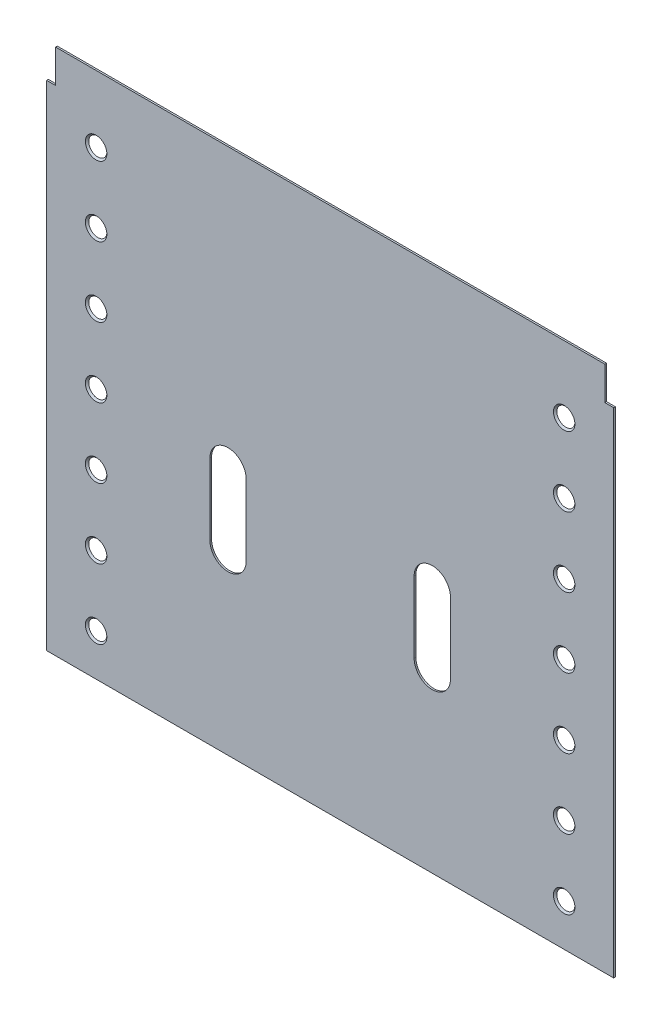
from build123d import *

# Parameters (mm, degrees)
SKETCH1_W                                      = 203.2
SKETCH1_H                                      = 177
BOSS_EXTRUDE1_DEPTH                            = 0.6096
CUT_EXTRUDE7_DEPTH                             = 313.185220041
SKETCH4_W                                      = 196.85
SKETCH4_H                                      = 0.6096
BOSS_EXTRUDE2_DEPTH                            = 12
SKETCH14_W                                     = 196.85
SKETCH14_H                                     = 11.938
BOSS_EXTRUDE3_DEPTH                            = 0.6096
SKETCH13_W                                     = 196.85
SKETCH13_H                                     = 0.6096
CUT_EXTRUDE9_DEPTH                             = 12
CSK_FOR_M3_FLAT_HEAD_MACHINE_SCREW3_AT_2_COUNT = 2
CSK_FOR_M3_FLAT_HEAD_MACHINE_SCREW3_AT_2_PITCH = 25
CSK_FOR_M3_FLAT_HEAD_MACHINE_SCREW3_AT_3_COUNT = 2
CSK_FOR_M3_FLAT_HEAD_MACHINE_SCREW3_AT_3_PITCH = 50
CSK_FOR_M3_FLAT_HEAD_MACHINE_SCREW3_AT_4_COUNT = 2
CSK_FOR_M3_FLAT_HEAD_MACHINE_SCREW3_AT_4_PITCH = 75
CSK_FOR_M3_FLAT_HEAD_MACHINE_SCREW3_AT_5_COUNT = 2
CSK_FOR_M3_FLAT_HEAD_MACHINE_SCREW3_AT_5_PITCH = 100
CSK_FOR_M3_FLAT_HEAD_MACHINE_SCREW3_AT_6_COUNT = 2
CSK_FOR_M3_FLAT_HEAD_MACHINE_SCREW3_AT_6_PITCH = 125
CSK_FOR_M3_FLAT_HEAD_MACHINE_SCREW3_AT_7_COUNT = 2
CSK_FOR_M3_FLAT_HEAD_MACHINE_SCREW3_AT_7_PITCH = 150


with BuildPart() as part:
    # Sketch1 → Boss-Extrude1 (new body)
    with BuildSketch(Plane(origin=(0, 0, 0), x_dir=(1, 0, 0), z_dir=(0, 0, -1))):
        with Locations((-101.6, 148.5)):
            Rectangle(SKETCH1_W, SKETCH1_H)
    extrude(amount=BOSS_EXTRUDE1_DEPTH)

    # Sketch2 → Cut-Extrude7 (cut, through all)
    with BuildSketch(Plane(origin=(0, 0, -0.6096), x_dir=(1, 0, 0), z_dir=(0, 0, -1))):
        with BuildLine():
            Line((-131.7, 173.5), (-131.7, 148))
            ThreePointArc((-131.7, 148), (-138.2, 141.5), (-144.7, 148))
            Line((-144.7, 148), (-144.7, 173.5))
            ThreePointArc((-144.7, 173.5), (-138.2, 180), (-131.7, 173.5))
        make_face()
        with BuildLine():
            Line((-58.5, 173.5), (-58.5, 148))
            ThreePointArc((-58.5, 148), (-65, 141.5), (-71.5, 148))
            Line((-71.5, 148), (-71.5, 173.5))
            ThreePointArc((-71.5, 173.5), (-65, 180), (-58.5, 173.5))
        make_face()
    extrude(amount=-CUT_EXTRUDE7_DEPTH, mode=Mode.SUBTRACT)

    # Sketch4 → Boss-Extrude2 (add)
    with BuildSketch(Plane.XY):
        with Locations((-101.6, -60.3048)):
            Rectangle(SKETCH4_W, SKETCH4_H)
    extrude(amount=BOSS_EXTRUDE2_DEPTH)

    # Sketch14 → Boss-Extrude3 (add)
    with BuildSketch(Plane.XY):
        with Locations((-101.6, -54.031)):
            Rectangle(SKETCH14_W, SKETCH14_H)
    extrude(amount=-BOSS_EXTRUDE3_DEPTH)

    # Sketch13 → Cut-Extrude9 (cut)
    with BuildSketch(Plane.XY.offset(12)):
        with Locations((-101.6, -60.3048)):
            Rectangle(SKETCH13_W, SKETCH13_H)
    extrude(amount=-CUT_EXTRUDE9_DEPTH, mode=Mode.SUBTRACT)

    # Sketch16 → CSK for M3 Flat Head Machine Screw3 (revolve, cut)
    with BuildSketch(Plane(origin=(-185.47, -222, 0), x_dir=(0, -1, 0), z_dir=(1, 0, 0))):
        Polygon((0, 0), (0, 0.6096), (1.7, 0.6096), (1.7, 2.15), (3.85, 0), align=None)
    csk_for_m3_flat_head_machine_screw3 = revolve(axis=Axis((-185.47, -222, 6.35), (0, 0, -1)), mode=Mode.SUBTRACT)

    # CSK for M3 Flat Head Machine Screw3 at 2: CSK for M3 Flat Head Machine Screw3 ×2
    with Locations(*[(0, i * CSK_FOR_M3_FLAT_HEAD_MACHINE_SCREW3_AT_2_PITCH, 0) for i in range(1, CSK_FOR_M3_FLAT_HEAD_MACHINE_SCREW3_AT_2_COUNT)]):
        add(csk_for_m3_flat_head_machine_screw3, mode=Mode.SUBTRACT)

    # CSK for M3 Flat Head Machine Screw3 at 3: CSK for M3 Flat Head Machine Screw3 ×2
    with Locations(*[(0, i * CSK_FOR_M3_FLAT_HEAD_MACHINE_SCREW3_AT_3_PITCH, 0) for i in range(1, CSK_FOR_M3_FLAT_HEAD_MACHINE_SCREW3_AT_3_COUNT)]):
        add(csk_for_m3_flat_head_machine_screw3, mode=Mode.SUBTRACT)

    # CSK for M3 Flat Head Machine Screw3 at 4: CSK for M3 Flat Head Machine Screw3 ×2
    with Locations(*[(0, i * CSK_FOR_M3_FLAT_HEAD_MACHINE_SCREW3_AT_4_PITCH, 0) for i in range(1, CSK_FOR_M3_FLAT_HEAD_MACHINE_SCREW3_AT_4_COUNT)]):
        add(csk_for_m3_flat_head_machine_screw3, mode=Mode.SUBTRACT)

    # CSK for M3 Flat Head Machine Screw3 at 5: CSK for M3 Flat Head Machine Screw3 ×2
    with Locations(*[(0, i * CSK_FOR_M3_FLAT_HEAD_MACHINE_SCREW3_AT_5_PITCH, 0) for i in range(1, CSK_FOR_M3_FLAT_HEAD_MACHINE_SCREW3_AT_5_COUNT)]):
        add(csk_for_m3_flat_head_machine_screw3, mode=Mode.SUBTRACT)

    # CSK for M3 Flat Head Machine Screw3 at 6: CSK for M3 Flat Head Machine Screw3 ×2
    with Locations(*[(0, i * CSK_FOR_M3_FLAT_HEAD_MACHINE_SCREW3_AT_6_PITCH, 0) for i in range(1, CSK_FOR_M3_FLAT_HEAD_MACHINE_SCREW3_AT_6_COUNT)]):
        add(csk_for_m3_flat_head_machine_screw3, mode=Mode.SUBTRACT)

    # CSK for M3 Flat Head Machine Screw3 at 7: CSK for M3 Flat Head Machine Screw3 ×2
    with Locations(*[(0, i * CSK_FOR_M3_FLAT_HEAD_MACHINE_SCREW3_AT_7_PITCH, 0) for i in range(1, CSK_FOR_M3_FLAT_HEAD_MACHINE_SCREW3_AT_7_COUNT)]):
        add(csk_for_m3_flat_head_machine_screw3, mode=Mode.SUBTRACT)

    # Mirror1: CSK for M3 Flat Head Machine Screw3 across plane
    add(csk_for_m3_flat_head_machine_screw3.mirror(Plane.ZY.offset(101.599999995)), mode=Mode.SUBTRACT)

    # Mirror1 copy 1 sketch → Mirror1 copy 1 (revolve, cut)
    with BuildSketch(Plane(origin=(-17.729999998, -197.000000003, 0), x_dir=(-3.839898042745385e-11, -1.0, 0), z_dir=(-1.0, 3.839898042745385e-11, 0))):
        Polygon((0, 0), (0, -0.6096), (1.7, -0.6096), (1.7, -2.15), (3.85, 0), align=None)
    revolve(axis=Axis((-17.729999998, -197.000000003, 6.35), (0, 0, 1)), mode=Mode.SUBTRACT)

    # Mirror1 copy 2 sketch → Mirror1 copy 2 (revolve, cut)
    with BuildSketch(Plane(origin=(-17.729999998, -172.000000003, 0), x_dir=(-3.839898042745385e-11, -1.0, 0), z_dir=(-1.0, 3.839898042745385e-11, 0))):
        Polygon((0, 0), (0, -0.6096), (1.7, -0.6096), (1.7, -2.15), (3.85, 0), align=None)
    revolve(axis=Axis((-17.729999998, -172.000000003, 6.35), (0, 0, 1)), mode=Mode.SUBTRACT)

    # Mirror1 copy 3 sketch → Mirror1 copy 3 (revolve, cut)
    with BuildSketch(Plane(origin=(-17.729999997, -147.000000003, 0), x_dir=(-3.839898042745385e-11, -1.0, 0), z_dir=(-1.0, 3.839898042745385e-11, 0))):
        Polygon((0, 0), (0, -0.6096), (1.7, -0.6096), (1.7, -2.15), (3.85, 0), align=None)
    revolve(axis=Axis((-17.729999997, -147.000000003, 6.35), (0, 0, 1)), mode=Mode.SUBTRACT)

    # Mirror1 copy 4 sketch → Mirror1 copy 4 (revolve, cut)
    with BuildSketch(Plane(origin=(-17.729999996, -122.000000003, 0), x_dir=(-3.839898042745385e-11, -1.0, 0), z_dir=(-1.0, 3.839898042745385e-11, 0))):
        Polygon((0, 0), (0, -0.6096), (1.7, -0.6096), (1.7, -2.15), (3.85, 0), align=None)
    revolve(axis=Axis((-17.729999996, -122.000000003, 6.35), (0, 0, 1)), mode=Mode.SUBTRACT)

    # Mirror1 copy 5 sketch → Mirror1 copy 5 (revolve, cut)
    with BuildSketch(Plane(origin=(-17.729999995, -97.000000003, 0), x_dir=(-3.839898042745385e-11, -1.0, 0), z_dir=(-1.0, 3.839898042745385e-11, 0))):
        Polygon((0, 0), (0, -0.6096), (1.7, -0.6096), (1.7, -2.15), (3.85, 0), align=None)
    revolve(axis=Axis((-17.729999995, -97.000000003, 6.35), (0, 0, 1)), mode=Mode.SUBTRACT)

    # Mirror1 copy 6 sketch → Mirror1 copy 6 (revolve, cut)
    with BuildSketch(Plane(origin=(-17.729999994, -72.000000003, 0), x_dir=(-3.839898042745385e-11, -1.0, 0), z_dir=(-1.0, 3.839898042745385e-11, 0))):
        Polygon((0, 0), (0, -0.6096), (1.7, -0.6096), (1.7, -2.15), (3.85, 0), align=None)
    revolve(axis=Axis((-17.729999994, -72.000000003, 6.35), (0, 0, 1)), mode=Mode.SUBTRACT)


solid = part.part
